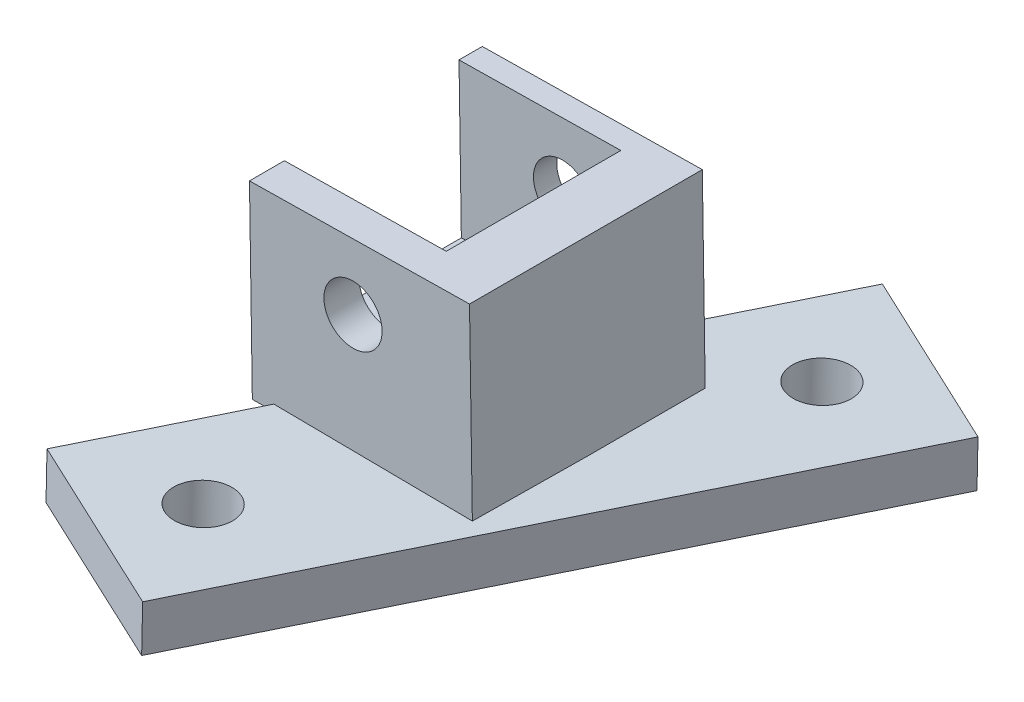
from build123d import *

# Parameters (mm, degrees)
BOSS_EXTRUDE1_DEPTH = 21.59
SKETCH2_R           = 3.175
BOSS_EXTRUDE2_DEPTH = 2.54
BOSS_EXTRUDE3_START = 3.81
SKETCH3_R           = 3.175
BOSS_EXTRUDE3_DEPTH = 3.81
SKETCH6_R           = 3.175
BOSS_EXTRUDE4_DEPTH = 5.08


with BuildPart() as part:
    # Sketch1 → Boss-Extrude1 (new body)
    with BuildSketch(Plane.XY):
        with BuildLine():
            Line((629.598897849, 94.164329766), (616.850918015, 93.969698502))
            Line((616.850918015, 93.969698502), (616.909080854, 90.16014248))
            Line((616.909080854, 90.16014248), (640.914721516, 90.52665139))
            Line((640.914721516, 90.52665139), (640.60180544, 111.022062787))
            Line((640.60180544, 111.022062787), (634.252545404, 110.925124722))
            ThreePointArc((634.252545404, 110.925124722), (637.543945735, 103.811741783), (634.47123768, 96.601194079))
            ThreePointArc((634.47123768, 96.601194079), (632.210560309, 95.031876848), (629.598897849, 94.164329766))
        make_face()
    extrude(amount=-BOSS_EXTRUDE1_DEPTH)

    # Sketch2 → Boss-Extrude2 (add)
    with BuildSketch(Plane(origin=(0, 0, -19.05), x_dir=(-1, 0, 0), z_dir=(0, 0, -1))):
        with BuildLine():
            Line((-616.850918015, 93.969698502), (-616.596164778, 110.655553878))
            Line((-616.596164778, 110.655553878), (-634.252545404, 110.925124722))
            ThreePointArc((-634.252545404, 110.925124722), (-637.193249895, 101.082193986), (-629.598897849, 94.164329766))
            Line((-629.598897849, 94.164329766), (-616.850918015, 93.969698502))
        make_face()
        with Locations(Location((-627.893070479, 103.664395923, 0), (0, 0, 180))):
            Circle(SKETCH2_R, mode=Mode.SUBTRACT)
    extrude(amount=BOSS_EXTRUDE2_DEPTH)

    # Sketch3 → Boss-Extrude3 (add)
    # profile 1 of 2: a face of its own
    with BuildSketch(Plane.XY.offset(BOSS_EXTRUDE3_START)):
        with BuildLine():
            Line((634.252545404, 110.925124722), (616.596164778, 110.655553878))
            Line((616.596164778, 110.655553878), (616.850918015, 93.969698502))
            Line((616.850918015, 93.969698502), (629.598897849, 94.164329766))
            ThreePointArc((629.598897849, 94.164329766), (637.193249895, 101.082193986), (634.252545404, 110.925124722))
        make_face()
        with Locations((627.893070479, 103.664395923)):
            Circle(SKETCH3_R, mode=Mode.SUBTRACT)
    # profile 2 of 2: a face of its own
    with BuildSketch(Plane.XY.offset(BOSS_EXTRUDE3_START)):
        with BuildLine():
            Line((640.60180544, 111.022062787), (634.252545404, 110.925124722))
            ThreePointArc((634.252545404, 110.925124722), (637.193249895, 101.082193986), (629.598897849, 94.164329766))
            Line((629.598897849, 94.164329766), (616.850918015, 93.969698502))
            Line((616.850918015, 93.969698502), (616.909080854, 90.16014248))
            Line((616.909080854, 90.16014248), (640.914721516, 90.52665139))
            Line((640.914721516, 90.52665139), (640.60180544, 111.022062787))
        make_face()
    extrude(amount=-BOSS_EXTRUDE3_DEPTH)

    # Sketch6 → Boss-Extrude4 (add)
    with BuildSketch(Plane(origin=(1.009584834, 97.256608571, -1.08885119), x_dir=(0.9999461323694532, -0.01037876956131086, 0.00011619709707159731), z_dir=(0.010379419992088221, 0.9998834703189057, -0.011194347843893874))):
        Polygon((629.970445875, -30.830778579), (658.964231573, 31.318853688), (639.3986066, 40.446526963), (610.404820902, -21.703105303), align=None)
        with Locations(Location((623.94608709, -18.210508129, 0), (0, 0, 270))):
            Circle(SKETCH6_R, mode=Mode.SUBTRACT)
        with Locations(Location((645.422965385, 27.826256513, 0), (0, 0, 270))):
            Circle(SKETCH6_R, mode=Mode.SUBTRACT)
    extrude(amount=-BOSS_EXTRUDE4_DEPTH)


solid = part.part
